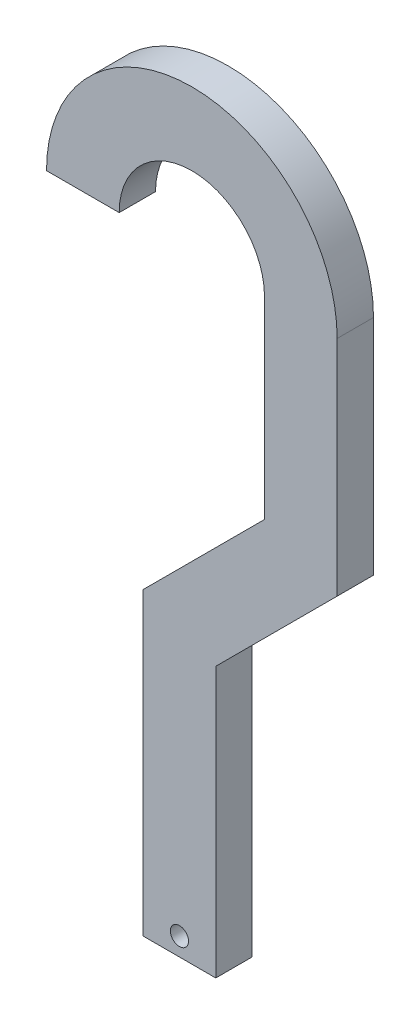
from build123d import *

# Parameters (mm, degrees)
BOSS_EXTRUDE1_DEPTH = 12.7
SKETCH2_R           = 3.175
CUT_EXTRUDE1_DEPTH  = 12.7


with BuildPart() as part:
    # Sketch1 → Boss-Extrude1 (new body)
    with BuildSketch(Plane.XY):
        with BuildLine():
            Line((-25.4, 6.391326247), (-25.4, 34.062325918))
            ThreePointArc((-25.4, 34.062325918), (-50.8, 59.462325918), (-76.2, 34.062325918))
            Line((-76.2, 34.062325918), (-101.6, 34.062325918))
            ThreePointArc((-101.6, 34.062325918), (-50.8, 84.862325918), (0, 34.062325918))
            Line((0, 34.062325918), (0, 0))
            Line((0, 0), (0, -43.954875224))
            Line((0, -43.954875224), (-42.435391943, -86.390267166))
            Line((-42.435391943, -86.390267166), (-42.435391943, -180.765389634))
            Line((-42.435391943, -180.765389634), (-67.835391943, -180.765389634))
            Line((-67.835391943, -180.765389634), (-67.835391943, -100.403593512))
            Line((-67.835391943, -100.403593512), (-67.835391943, -75.869242682))
            Line((-67.835391943, -75.869242682), (-25.4, -33.433850739))
            Line((-25.4, -33.433850739), (-25.4, 6.391326247))
        make_face()
    extrude(amount=BOSS_EXTRUDE1_DEPTH)

    # Sketch2 → Cut-Extrude1 (cut)
    with BuildSketch(Plane.XY.offset(12.7)):
        with Locations((-55.135391943, -174.415389634)):
            Circle(SKETCH2_R)
    extrude(amount=-CUT_EXTRUDE1_DEPTH, mode=Mode.SUBTRACT)


solid = part.part
